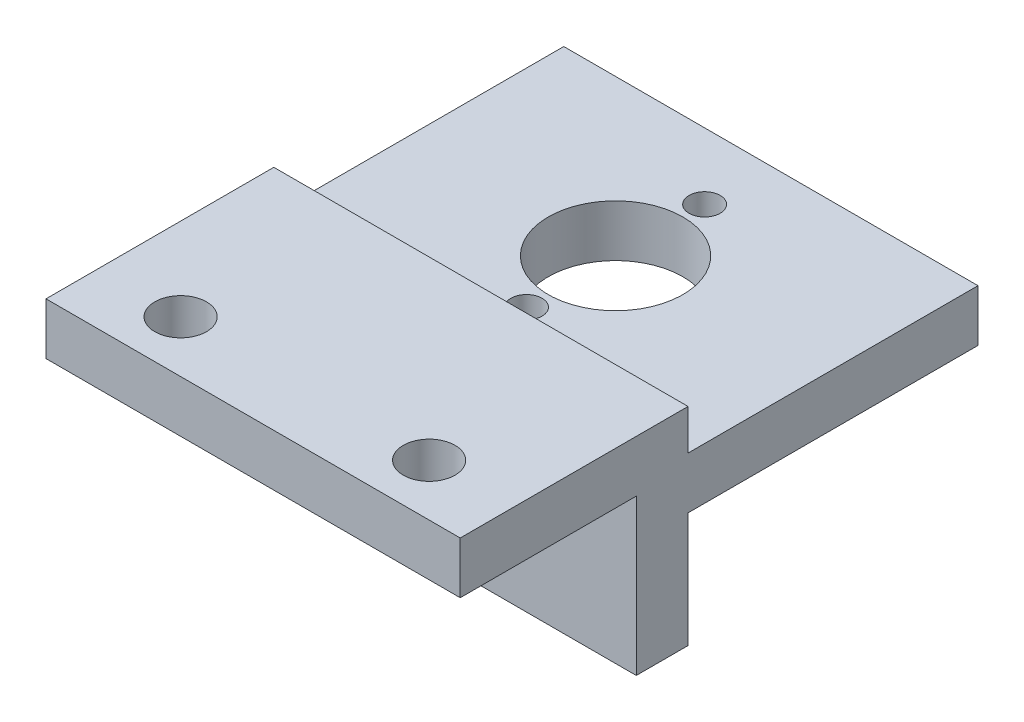
from build123d import *

# Parameters (mm, degrees)
SKETCH3_W               = 40
SKETCH3_H               = 50
BOSS_EXTRUDE1_DEPTH     = 5
SKETCH6_R               = 2.5
CUT_EXTRUDE6_DEPTH      = 41.620192023
SKETCH7_W               = 40
SKETCH7_H               = 5
BOSS_EXTRUDE2_DEPTH     = 15
SKETCH8_W               = 40
SKETCH8_H               = 28
BOSS_EXTRUDE3_DEPTH     = 3.9
CUT_EXTRUDE3_DEPTH      = 44.011626335
CUT_EXTRUDE3_DEPTH_BACK = 44.011626335
SKETCH1_R               = 6.5
SKETCH1_R_2             = 1.5
CUT_EXTRUDE7_REACH      = 57.227
SKETCH9_W               = 28
SKETCH9_H               = 3.9


with BuildPart() as part:
    # Sketch3 → Boss-Extrude1 (new body)
    with BuildSketch(Plane(origin=(0, 0, 0), x_dir=(1, 0, 0), z_dir=(0, 1, 0))):
        with Locations((0, -10)):
            Rectangle(SKETCH3_W, SKETCH3_H)
    extrude(amount=BOSS_EXTRUDE1_DEPTH)

    # Sketch6 → Cut-Extrude6 (cut, through all)
    with BuildSketch(Plane(origin=(0, 5, 0), x_dir=(1, 0, 0), z_dir=(0, 1, 0))):
        with Locations(Location((-12, -30, 0), (0, 0, 270))):
            Circle(SKETCH6_R)
        with Locations(Location((12, -30, 0), (0, 0, 270))):
            Circle(SKETCH6_R)
    extrude(amount=-CUT_EXTRUDE6_DEPTH, mode=Mode.SUBTRACT)

    # Sketch7 → Boss-Extrude2 (add)
    with BuildSketch(Plane.XZ):
        with Locations((0, 15.5)):
            Rectangle(SKETCH7_W, SKETCH7_H)
    extrude(amount=BOSS_EXTRUDE2_DEPTH)

    # Sketch8 → Boss-Extrude3 (add)
    with BuildSketch(Plane.XZ):
        with Locations((0, -1)):
            Rectangle(SKETCH8_W, SKETCH8_H)
    extrude(amount=BOSS_EXTRUDE3_DEPTH)

    # Sketch1 → Cut-Extrude3 (cut, two sides: drawn at the far end of the back side and taken through both)
    with BuildSketch(Plane(origin=(0, 0, 0), x_dir=(1, 0, 0), z_dir=(0, 1, 0)).offset(-CUT_EXTRUDE3_DEPTH_BACK)):
        with Locations(Location((0, 0, 0), (0, 0, 90))):
            Circle(SKETCH1_R)
        with Locations(Location((0, 8.6, 0), (0, 0, 90))):
            Circle(SKETCH1_R_2)
        with Locations(Location((0, -8.6, 0), (0, 0, 90))):
            Circle(SKETCH1_R_2)
    extrude(amount=CUT_EXTRUDE3_DEPTH + CUT_EXTRUDE3_DEPTH_BACK, mode=Mode.SUBTRACT)

    # Cut-Extrude7: up to this face of the body (flat: up to its plane)
    cut_extrude7_end = Plane(part.part.faces().sort_by_distance((20, -0.346476278, 8.183555965))[0])
    # Sketch9 → Cut-Extrude7 (cut, up to the picked face)
    with BuildSketch(Plane.ZY.offset(20), mode=Mode.PRIVATE) as cut_extrude7_sk1:
        with Locations((-1, 3.05)):
            Rectangle(SKETCH9_W, SKETCH9_H)
    cut_extrude7_tool1 = split(extrude(cut_extrude7_sk1.sketch, amount=-CUT_EXTRUDE7_REACH, mode=Mode.PRIVATE), bisect_by=cut_extrude7_end, keep=Keep.BOTH, mode=Mode.PRIVATE)
    add(cut_extrude7_tool1.solids().sort_by(Axis((-20, 3.05, -1), (1, 0, 0)))[0], mode=Mode.SUBTRACT)


solid = part.part
